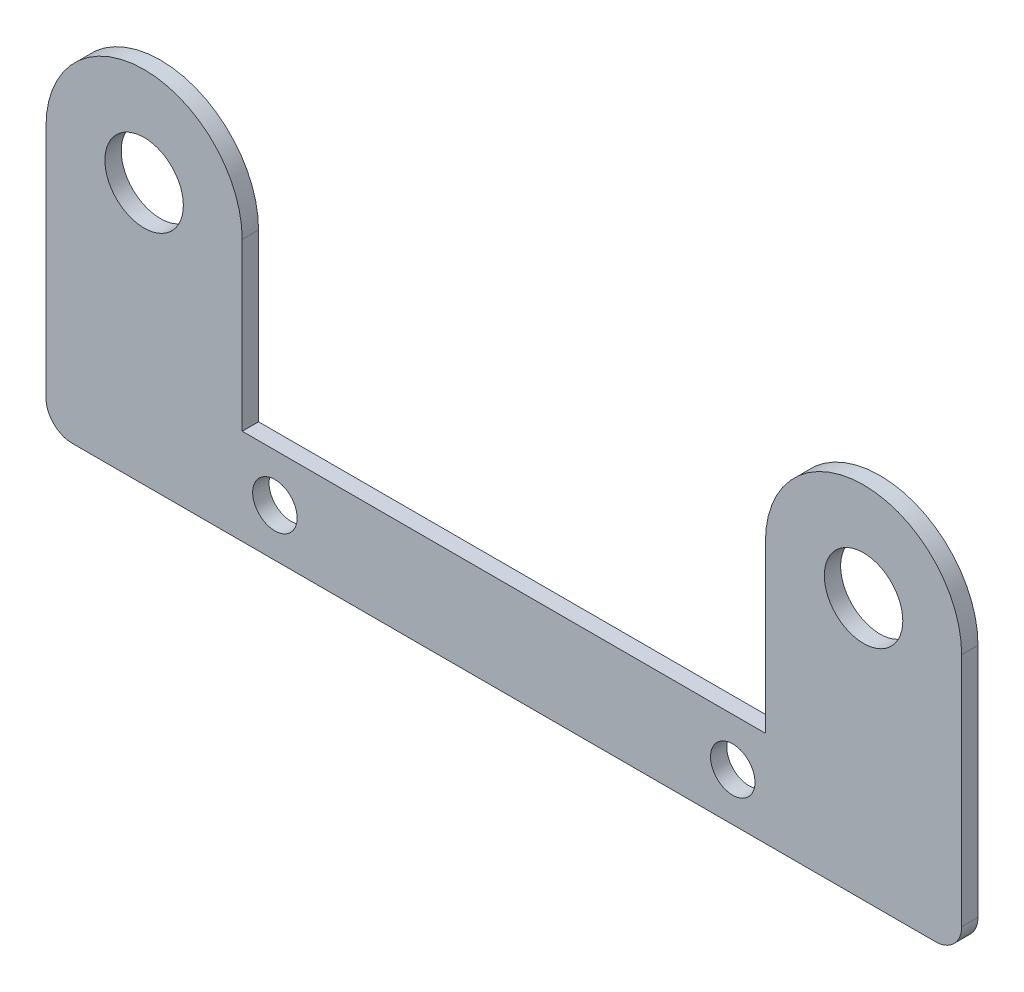
from build123d import *

# Parameters (mm, degrees)
SKETCH1_R           = 2.159
SKETCH1_R_2         = 3.81
BOSS_EXTRUDE1_DEPTH = 1.5875
FILLET1_R           = 2.54


with BuildPart() as part:
    # Sketch1 → Boss-Extrude1 (new body)
    with BuildSketch(Plane.XY):
        with BuildLine():
            Line((0, 25.4), (0, 0))
            Line((0, 0), (88.9, 0))
            Line((88.9, 0), (88.9, 25.4))
            ThreePointArc((88.9, 25.4), (79.375, 34.925), (69.85, 25.4))
            Line((69.85, 25.4), (69.85, 9.271))
            Line((69.85, 9.271), (19.05, 9.271))
            Line((19.05, 9.271), (19.05, 25.4))
            ThreePointArc((19.05, 25.4), (9.525, 34.925), (0, 25.4))
        make_face()
        with Locations((22.225, 4.6355)):
            Circle(SKETCH1_R, mode=Mode.SUBTRACT)
        with Locations((66.675, 4.6355)):
            Circle(SKETCH1_R, mode=Mode.SUBTRACT)
        with Locations((9.525, 25.4)):
            Circle(SKETCH1_R_2, mode=Mode.SUBTRACT)
        with Locations((79.375, 25.4)):
            Circle(SKETCH1_R_2, mode=Mode.SUBTRACT)
    extrude(amount=BOSS_EXTRUDE1_DEPTH)

    # Fillet1
    fillet1_edges = [part.edges().sort_by_distance(p)[0] for p in [
        (88.9, 0, 0.79375),
        (0, 0, 0.79375),
    ]]
    fillet(fillet1_edges, radius=FILLET1_R)


solid = part.part
